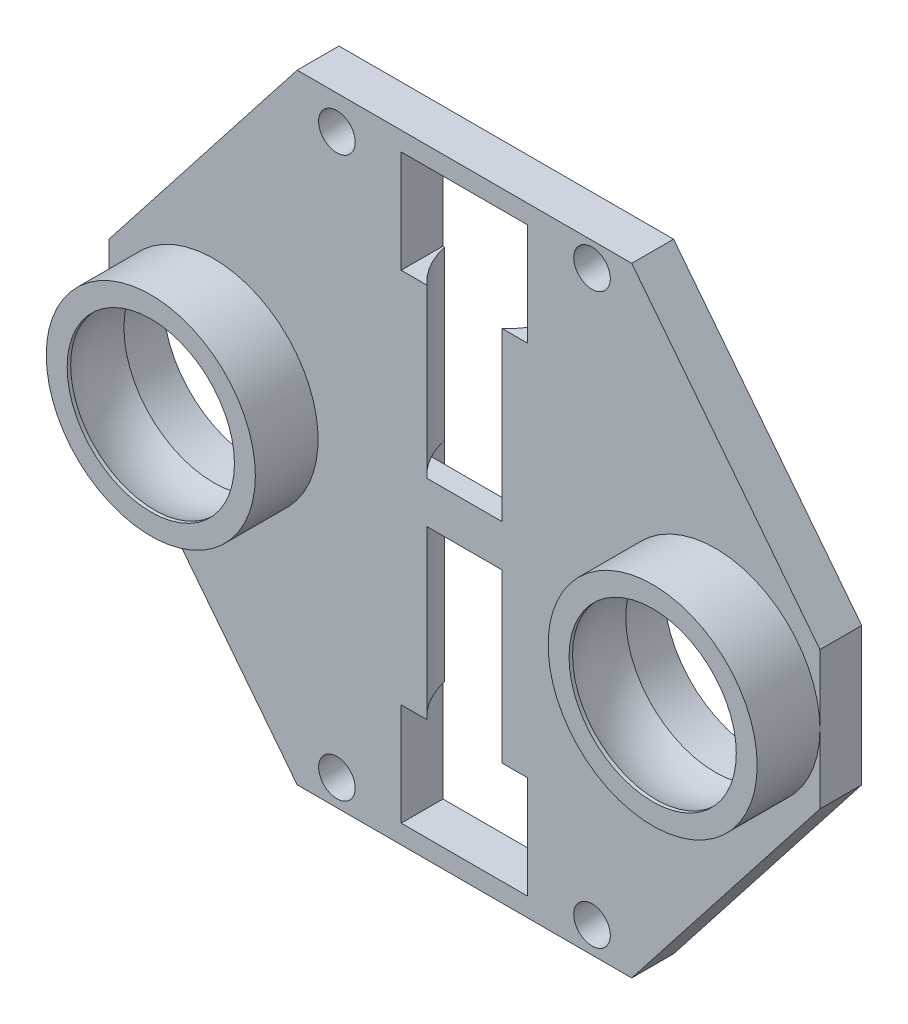
from build123d import *

# Parameters (mm, degrees)
CROQUIS1_W               = 22
CROQUIS1_H               = 55.2
SALIENTE_EXTRUIR1_DEPTH  = 4
CROQUIS2_W               = 12.1
CROQUIS2_H               = 4
CORTAR_EXTRUIR1_DEPTH    = 9.6
CROQUIS3_W               = 12.1
CROQUIS3_H               = 4
CORTAR_EXTRUIR2_DEPTH    = 9.6
CORTAR_EXTRUIR3_DEPTH    = 16
CORTAR_EXTRUIR4_START    = -16
CORTAR_EXTRUIR4_DEPTH    = 16
CROQUIS9_W               = 11.778481694
CROQUIS9_H               = 4
CORTAR_EXTRUIR5_DEPTH    = 2
CROQUIS11_W              = 4.95
CROQUIS11_H              = 4
SALIENTE_EXTRUIR3_DEPTH  = 2
CROQUIS12_W              = 4
CROQUIS12_H              = 1.8
SALIENTE_EXTRUIR4_DEPTH  = 12.1
CROQUIS13_W              = 4.95
CROQUIS13_H              = 4
SALIENTE_EXTRUIR5_DEPTH  = 2
CROQUIS14_W              = 4
CROQUIS14_H              = 1.8
SALIENTE_EXTRUIR6_DEPTH  = 12.1
CROQUIS17_W              = 4
CROQUIS17_H              = 59.2
SALIENTE_EXTRUIR8_DEPTH  = 23
CROQUIS18_W              = 4
CROQUIS18_H              = 59.2
SALIENTE_EXTRUIR9_DEPTH  = 23
CROQUIS19_R              = 1.75
CORTAR_EXTRUIR6_DEPTH    = 11.5
CROQUIS20_R              = 8.8
CROQUIS20_R_2            = 8.901027098
CORTAR_EXTRUIR7_DEPTH    = 4
CORTAR_EXTRUIR8_DEPTH    = 10
CROQUIS22_R              = 10
CROQUIS22_R_2            = 8
SALIENTE_EXTRUIR10_DEPTH = 6


with BuildPart() as part:
    # Croquis1 → Saliente-Extruir1 (new body)
    with BuildSketch(Plane.XY):
        with Locations((11, 27.6)):
            Rectangle(CROQUIS1_W, CROQUIS1_H)
    extrude(amount=SALIENTE_EXTRUIR1_DEPTH)

    # Croquis2 → Cortar-Extruir1 (cut)
    with BuildSketch(Plane(origin=(0, 55.2, 0), x_dir=(1, 0, 0), z_dir=(0, 1, 0))):
        with Locations((11, -2)):
            Rectangle(CROQUIS2_W, CROQUIS2_H)
    extrude(amount=-CORTAR_EXTRUIR1_DEPTH, mode=Mode.SUBTRACT)

    # Croquis3 → Cortar-Extruir2 (cut)
    with BuildSketch(Plane.XZ):
        with Locations((11, 2)):
            Rectangle(CROQUIS3_W, CROQUIS3_H)
    extrude(amount=-CORTAR_EXTRUIR2_DEPTH, mode=Mode.SUBTRACT)

    # Croquis5 → Cortar-Extruir3 (cut)
    with BuildSketch(Plane.XZ.offset(-9.6)):
        with BuildLine():
            Line((7.4, 4), (14.6, 4))
            ThreePointArc((14.6, 4), (16.401151853, 1.506649462), (17.05, -1.5))
            Line((17.05, -1.5), (4.95, -1.5))
            ThreePointArc((4.95, -1.5), (5.598848147, 1.506649462), (7.4, 4))
        make_face()
    extrude(amount=-CORTAR_EXTRUIR3_DEPTH, mode=Mode.SUBTRACT)

    # Croquis7 → Cortar-Extruir4 (cut)
    with BuildSketch(Plane(origin=(0, 45.6, 0), x_dir=(1, 0, 0), z_dir=(0, 1, 0)).offset(CORTAR_EXTRUIR4_START)):
        with BuildLine():
            Line((4.95, 1.5), (17.05, 1.5))
            ThreePointArc((17.05, 1.5), (16.401151853, -1.506649462), (14.6, -4))
            Line((14.6, -4), (7.4, -4))
            ThreePointArc((7.4, -4), (5.598848147, -1.506649462), (4.95, 1.5))
        make_face()
    extrude(amount=CORTAR_EXTRUIR4_DEPTH, mode=Mode.SUBTRACT)

    # Croquis9 → Cortar-Extruir5 (cut)
    with BuildSketch(Plane(origin=(0, 0, 0), x_dir=(-1, 0, 0), z_dir=(0, 0, -1))):
        with Locations((-11, 27.6)):
            Rectangle(CROQUIS9_W, CROQUIS9_H)
    extrude(amount=-CORTAR_EXTRUIR5_DEPTH, mode=Mode.SUBTRACT)

    # Croquis11 → Saliente-Extruir3 (add)
    with BuildSketch(Plane(origin=(0, 55.2, 0), x_dir=(1, 0, 0), z_dir=(0, 1, 0))):
        with Locations((2.475, -2)):
            Rectangle(CROQUIS11_W, CROQUIS11_H)
        with Locations((19.525, -2)):
            Rectangle(CROQUIS11_W, CROQUIS11_H)
    extrude(amount=SALIENTE_EXTRUIR3_DEPTH)

    # Croquis12 → Saliente-Extruir4 (add)
    with BuildSketch(Plane(origin=(4.95, 0, 0), x_dir=(0, 0, -1), z_dir=(1, 0, 0))):
        with Locations((-2, 56.3)):
            Rectangle(CROQUIS12_W, CROQUIS12_H)
    extrude(amount=SALIENTE_EXTRUIR4_DEPTH)

    # Croquis13 → Saliente-Extruir5 (add)
    with BuildSketch(Plane.XZ):
        with Locations((19.525, 2)):
            Rectangle(CROQUIS13_W, CROQUIS13_H)
        with Locations((2.475, 2)):
            Rectangle(CROQUIS13_W, CROQUIS13_H)
    extrude(amount=SALIENTE_EXTRUIR5_DEPTH)

    # Croquis14 → Saliente-Extruir6 (add)
    with BuildSketch(Plane(origin=(4.95, 0, 0), x_dir=(0, 0, -1), z_dir=(1, 0, 0))):
        with Locations((-2, -1.1)):
            Rectangle(CROQUIS14_W, CROQUIS14_H)
    extrude(amount=SALIENTE_EXTRUIR6_DEPTH)

    # Croquis17 → Saliente-Extruir8 (add)
    with BuildSketch(Plane.ZY):
        with Locations((2, 27.6)):
            Rectangle(CROQUIS17_W, CROQUIS17_H)
    extrude(amount=SALIENTE_EXTRUIR8_DEPTH)

    # Croquis18 → Saliente-Extruir9 (add)
    with BuildSketch(Plane(origin=(22, 0, 0), x_dir=(0, 0, -1), z_dir=(1, 0, 0))):
        with Locations((-2, 27.6)):
            Rectangle(CROQUIS18_W, CROQUIS18_H)
    extrude(amount=SALIENTE_EXTRUIR9_DEPTH)

    # Croquis19 → Cortar-Extruir6 (cut)
    with BuildSketch(Plane(origin=(0, 0, 0), x_dir=(-1, 0, 0), z_dir=(0, 0, -1))):
        with Locations((-23.2, 54.9)):
            Circle(CROQUIS19_R)
        with Locations((1.2, 54)):
            Circle(CROQUIS19_R)
        with Locations((1.2, 0.5)):
            Circle(CROQUIS19_R)
        with Locations((-23.2, 0.5)):
            Circle(CROQUIS19_R)
    extrude(amount=-CORTAR_EXTRUIR6_DEPTH, mode=Mode.SUBTRACT)

    # Croquis20 → Cortar-Extruir7 (cut)
    with BuildSketch(Plane(origin=(0, 0, 0), x_dir=(-1, 0, 0), z_dir=(0, 0, -1))):
        with Locations((13, 27.6)):
            Circle(CROQUIS20_R)
        with Locations((-35, 27.6)):
            Circle(CROQUIS20_R_2)
    extrude(amount=-CORTAR_EXTRUIR7_DEPTH, mode=Mode.SUBTRACT)

    # Croquis21 → Cortar-Extruir8 (cut)
    with BuildSketch(Plane(origin=(0, 0, 0), x_dir=(-1, 0, 0), z_dir=(0, 0, -1))):
        Polygon((-45, 57.2), (-45, 34.2), (-27, 57.2), align=None)
        Polygon((-45, -2), (-45, 21), (-27, -2), align=None)
        Polygon((23, 57.2), (23, 34.2), (5, 57.2), align=None)
        Polygon((23, -2), (23, 21), (5, -2), align=None)
    extrude(amount=-CORTAR_EXTRUIR8_DEPTH, mode=Mode.SUBTRACT)

    # Croquis22 → Saliente-Extruir10 (add)
    # profile 1 of 2: a face of its own
    with BuildSketch(Plane.XY.offset(4)):
        with Locations((35, 27.6)):
            Circle(CROQUIS22_R)
        with Locations((35, 27.6)):
            Circle(CROQUIS22_R_2, mode=Mode.SUBTRACT)
    # profile 2 of 2: a face of its own
    with BuildSketch(Plane.XY.offset(4)):
        with Locations(Location((-13, 27.6, 0), (0, 0, 180))):
            Circle(CROQUIS22_R)
        with Locations((-13, 27.6)):
            Circle(CROQUIS22_R_2, mode=Mode.SUBTRACT)
    extrude(amount=SALIENTE_EXTRUIR10_DEPTH)

    # Croquis23 → Cortar-Revolución1 (revolve, cut)
    with BuildSketch(Plane.XY.offset(6)):
        with BuildLine():
            Line((43.8, 27.6), (26.2, 27.6))
            ThreePointArc((26.2, 27.6), (35, 36.4), (43.8, 27.6))
        make_face()
    revolve(axis=Axis((43.8, 27.6, 6), (-1, 0, 0)), mode=Mode.SUBTRACT)

    # Croquis24 → Cortar-Revolución2 (revolve, cut)
    with BuildSketch(Plane.XY.offset(6)):
        with BuildLine():
            Line((-13, 36.4), (-13, 18.8))
            ThreePointArc((-13, 18.8), (-21.8, 27.6), (-13, 36.4))
        make_face()
    revolve(axis=Axis((-13, 36.4, 6), (0, -1, 0)), mode=Mode.SUBTRACT)


solid = part.part
